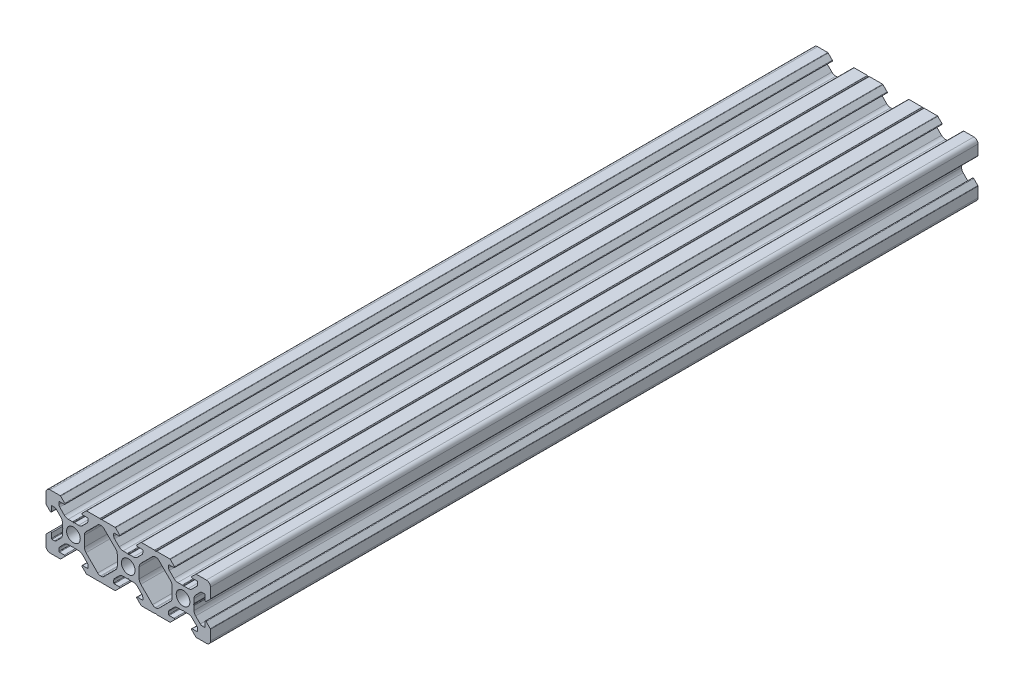
from build123d import *

# Parameters (mm, degrees)
SKETCH_187_R      = 2.5
EXTRUDE_748_DEPTH = 280


with BuildPart() as part:
    # Sketch 187 → Extrude 748 (new body)
    with BuildSketch(Plane.XY):
        with BuildLine():
            Line((37.369052302, 79.809178346), (37.369052302, 81.370263751))
            ThreePointArc((37.369052302, 81.370263751), (37.216811367, 82.135630615), (36.783265864, 82.784477313))
            Line((36.783265864, 82.784477313), (35.089153315, 84.478589863))
            ThreePointArc((35.089153315, 84.478589863), (34.764729966, 84.695362614), (34.382046533, 84.771483082))
            Line((34.382046533, 84.771483082), (33.569052302, 84.771483082))
            ThreePointArc((33.569052302, 84.771483082), (33.427630946, 84.712904438), (33.369052302, 84.571483082))
            Line((33.369052302, 84.571483082), (33.369052302, 82.801483082))
            ThreePointArc((33.369052302, 82.801483082), (33.21472316, 82.570513199), (32.942275607, 82.624706386))
            Line((32.942275607, 82.624706386), (31.442275607, 84.124706386))
            ThreePointArc((31.442275607, 84.124706386), (31.388082419, 84.205812224), (31.369052302, 84.301483082))
            Line((31.369052302, 84.301483082), (31.369052302, 87.971483082))
            ThreePointArc((31.369052302, 87.971483082), (31.80839213, 89.032143253), (32.869052302, 89.471483082))
            Line((32.869052302, 89.471483082), (36.539052302, 89.471483082))
            ThreePointArc((36.539052302, 89.471483082), (36.63472316, 89.452452965), (36.715828997, 89.398259777))
            Line((36.715828997, 89.398259777), (38.215828997, 87.898259777))
            ThreePointArc((38.215828997, 87.898259777), (38.270022185, 87.625812224), (38.039052302, 87.471483082))
            Line((38.039052302, 87.471483082), (36.269052302, 87.471483082))
            ThreePointArc((36.269052302, 87.471483082), (36.127630946, 87.412904438), (36.069052302, 87.271483082))
            Line((36.069052302, 87.271483082), (36.069052302, 86.45848885))
            ThreePointArc((36.069052302, 86.45848885), (36.145172769, 86.075805418), (36.361945521, 85.751382069))
            Line((36.361945521, 85.751382069), (38.05605807, 84.057269519))
            ThreePointArc((38.05605807, 84.057269519), (38.704904768, 83.623724017), (39.470271633, 83.471483082))
            Line((39.470271633, 83.471483082), (41.031357037, 83.471483082))
            ThreePointArc((41.031357037, 83.471483082), (41.114108772, 83.457390161), (41.187530799, 83.416700284))
            Line((41.187530799, 83.416700284), (41.369052302, 83.271483082))
            Line((41.369052302, 83.271483082), (41.550573805, 83.416700284))
            ThreePointArc((41.550573805, 83.416700284), (41.623995831, 83.457390161), (41.706747567, 83.471483082))
            Line((41.706747567, 83.471483082), (43.267832971, 83.471483082))
            ThreePointArc((43.267832971, 83.471483082), (44.033199836, 83.623724017), (44.682046533, 84.057269519))
            Line((44.682046533, 84.057269519), (46.376159083, 85.751382069))
            ThreePointArc((46.376159083, 85.751382069), (46.592931834, 86.075805418), (46.669052302, 86.45848885))
            Line((46.669052302, 86.45848885), (46.669052302, 87.271483082))
            ThreePointArc((46.669052302, 87.271483082), (46.610473658, 87.412904438), (46.469052302, 87.471483082))
            Line((46.469052302, 87.471483082), (44.699052302, 87.471483082))
            ThreePointArc((44.699052302, 87.471483082), (44.468082419, 87.625812224), (44.522275607, 87.898259777))
            Line((44.522275607, 87.898259777), (46.022275607, 89.398259777))
            ThreePointArc((46.022275607, 89.398259777), (46.103381444, 89.452452965), (46.199052302, 89.471483082))
            Line((46.199052302, 89.471483082), (50.993358392, 89.471483082))
            ThreePointArc((50.993358392, 89.471483082), (51.06580443, 89.460756088), (51.132033441, 89.429495655))
            Line((51.132033441, 89.429495655), (51.369052302, 89.271483082))
            Line((51.369052302, 89.271483082), (51.606071162, 89.429495655))
            ThreePointArc((51.606071162, 89.429495655), (51.672300174, 89.460756088), (51.744746211, 89.471483082))
            Line((51.744746211, 89.471483082), (56.539052302, 89.471483082))
            ThreePointArc((56.539052302, 89.471483082), (56.63472316, 89.452452965), (56.715828997, 89.398259777))
            Line((56.715828997, 89.398259777), (58.215828997, 87.898259777))
            ThreePointArc((58.215828997, 87.898259777), (58.270022185, 87.625812224), (58.039052302, 87.471483082))
            Line((58.039052302, 87.471483082), (56.269052302, 87.471483082))
            ThreePointArc((56.269052302, 87.471483082), (56.127630946, 87.412904438), (56.069052302, 87.271483082))
            Line((56.069052302, 87.271483082), (56.069052302, 86.45848885))
            ThreePointArc((56.069052302, 86.45848885), (56.145172769, 86.075805418), (56.361945521, 85.751382069))
            Line((56.361945521, 85.751382069), (58.05605807, 84.057269519))
            ThreePointArc((58.05605807, 84.057269519), (58.704904768, 83.623724017), (59.470271633, 83.471483082))
            Line((59.470271633, 83.471483082), (61.031357037, 83.471483082))
            ThreePointArc((61.031357037, 83.471483082), (61.114108772, 83.457390161), (61.187530799, 83.416700284))
            Line((61.187530799, 83.416700284), (61.369052302, 83.271483082))
            Line((61.369052302, 83.271483082), (61.550573805, 83.416700284))
            ThreePointArc((61.550573805, 83.416700284), (61.623995831, 83.457390161), (61.706747567, 83.471483082))
            Line((61.706747567, 83.471483082), (63.267832971, 83.471483082))
            ThreePointArc((63.267832971, 83.471483082), (64.033199836, 83.623724017), (64.682046533, 84.057269519))
            Line((64.682046533, 84.057269519), (66.376159083, 85.751382069))
            ThreePointArc((66.376159083, 85.751382069), (66.592931834, 86.075805418), (66.669052302, 86.45848885))
            Line((66.669052302, 86.45848885), (66.669052302, 87.271483082))
            ThreePointArc((66.669052302, 87.271483082), (66.610473658, 87.412904438), (66.469052302, 87.471483082))
            Line((66.469052302, 87.471483082), (64.699052302, 87.471483082))
            ThreePointArc((64.699052302, 87.471483082), (64.468082419, 87.625812224), (64.522275607, 87.898259777))
            Line((64.522275607, 87.898259777), (66.022275607, 89.398259777))
            ThreePointArc((66.022275607, 89.398259777), (66.103381444, 89.452452965), (66.199052302, 89.471483082))
            Line((66.199052302, 89.471483082), (70.993358392, 89.471483082))
            ThreePointArc((70.993358392, 89.471483082), (71.06580443, 89.460756088), (71.132033441, 89.429495655))
            Line((71.132033441, 89.429495655), (71.369052302, 89.271483082))
            Line((71.369052302, 89.271483082), (71.606071162, 89.429495655))
            ThreePointArc((71.606071162, 89.429495655), (71.672300174, 89.460756088), (71.744746211, 89.471483082))
            Line((71.744746211, 89.471483082), (76.539052302, 89.471483082))
            ThreePointArc((76.539052302, 89.471483082), (76.63472316, 89.452452965), (76.715828997, 89.398259777))
            Line((76.715828997, 89.398259777), (78.215828997, 87.898259777))
            ThreePointArc((78.215828997, 87.898259777), (78.270022185, 87.625812224), (78.039052302, 87.471483082))
            Line((78.039052302, 87.471483082), (76.269052302, 87.471483082))
            ThreePointArc((76.269052302, 87.471483082), (76.127630946, 87.412904438), (76.069052302, 87.271483082))
            Line((76.069052302, 87.271483082), (76.069052302, 86.45848885))
            ThreePointArc((76.069052302, 86.45848885), (76.145172769, 86.075805418), (76.361945521, 85.751382069))
            Line((76.361945521, 85.751382069), (78.05605807, 84.057269519))
            ThreePointArc((78.05605807, 84.057269519), (78.704904768, 83.623724017), (79.470271633, 83.471483082))
            Line((79.470271633, 83.471483082), (81.031357037, 83.471483082))
            ThreePointArc((81.031357037, 83.471483082), (81.114108772, 83.457390161), (81.187530799, 83.416700284))
            Line((81.187530799, 83.416700284), (81.369052302, 83.271483082))
            Line((81.369052302, 83.271483082), (81.550573805, 83.416700284))
            ThreePointArc((81.550573805, 83.416700284), (81.623995831, 83.457390161), (81.706747567, 83.471483082))
            Line((81.706747567, 83.471483082), (83.267832971, 83.471483082))
            ThreePointArc((83.267832971, 83.471483082), (84.033199836, 83.623724017), (84.682046533, 84.057269519))
            Line((84.682046533, 84.057269519), (86.376159083, 85.751382069))
            ThreePointArc((86.376159083, 85.751382069), (86.592931834, 86.075805418), (86.669052302, 86.45848885))
            Line((86.669052302, 86.45848885), (86.669052302, 87.271483082))
            ThreePointArc((86.669052302, 87.271483082), (86.610473658, 87.412904438), (86.469052302, 87.471483082))
            Line((86.469052302, 87.471483082), (84.699052302, 87.471483082))
            ThreePointArc((84.699052302, 87.471483082), (84.468082419, 87.625812224), (84.522275607, 87.898259777))
            Line((84.522275607, 87.898259777), (86.022275607, 89.398259777))
            ThreePointArc((86.022275607, 89.398259777), (86.103381444, 89.452452965), (86.199052302, 89.471483082))
            Line((86.199052302, 89.471483082), (89.869052302, 89.471483082))
            ThreePointArc((89.869052302, 89.471483082), (90.929712474, 89.032143253), (91.369052302, 87.971483082))
            Line((91.369052302, 87.971483082), (91.369052302, 84.301483082))
            ThreePointArc((91.369052302, 84.301483082), (91.350022185, 84.205812224), (91.295828997, 84.124706386))
            Line((91.295828997, 84.124706386), (89.795828997, 82.624706386))
            ThreePointArc((89.795828997, 82.624706386), (89.523381444, 82.570513199), (89.369052302, 82.801483082))
            Line((89.369052302, 82.801483082), (89.369052302, 84.571483082))
            ThreePointArc((89.369052302, 84.571483082), (89.310473658, 84.712904438), (89.169052302, 84.771483082))
            Line((89.169052302, 84.771483082), (88.35605807, 84.771483082))
            ThreePointArc((88.35605807, 84.771483082), (87.973374638, 84.695362614), (87.648951289, 84.478589863))
            Line((87.648951289, 84.478589863), (85.954838739, 82.784477313))
            ThreePointArc((85.954838739, 82.784477313), (85.521293237, 82.135630615), (85.369052302, 81.370263751))
            Line((85.369052302, 81.370263751), (85.369052302, 79.809178346))
            ThreePointArc((85.369052302, 79.809178346), (85.354959382, 79.726426611), (85.314269504, 79.653004585))
            Line((85.314269504, 79.653004585), (85.169052302, 79.471483082))
            Line((85.169052302, 79.471483082), (85.314269504, 79.289961579))
            ThreePointArc((85.314269504, 79.289961579), (85.354959382, 79.216539552), (85.369052302, 79.133787817))
            Line((85.369052302, 79.133787817), (85.369052302, 77.572702413))
            ThreePointArc((85.369052302, 77.572702413), (85.521293237, 76.807335548), (85.954838739, 76.15848885))
            Line((85.954838739, 76.15848885), (87.648951289, 74.4643763))
            ThreePointArc((87.648951289, 74.4643763), (87.973374638, 74.247603549), (88.35605807, 74.171483082))
            Line((88.35605807, 74.171483082), (89.169052302, 74.171483082))
            ThreePointArc((89.169052302, 74.171483082), (89.310473658, 74.230061725), (89.369052302, 74.371483082))
            Line((89.369052302, 74.371483082), (89.369052302, 76.141483082))
            ThreePointArc((89.369052302, 76.141483082), (89.523381444, 76.372452965), (89.795828997, 76.318259777))
            Line((89.795828997, 76.318259777), (91.295828997, 74.818259777))
            ThreePointArc((91.295828997, 74.818259777), (91.350022185, 74.73715394), (91.369052302, 74.641483082))
            Line((91.369052302, 74.641483082), (91.369052302, 70.971483082))
            ThreePointArc((91.369052302, 70.971483082), (90.929712474, 69.91082291), (89.869052302, 69.471483082))
            Line((89.869052302, 69.471483082), (86.199052302, 69.471483082))
            ThreePointArc((86.199052302, 69.471483082), (86.103381444, 69.490513199), (86.022275607, 69.544706386))
            Line((86.022275607, 69.544706386), (84.522275607, 71.044706386))
            ThreePointArc((84.522275607, 71.044706386), (84.468082419, 71.31715394), (84.699052302, 71.471483082))
            Line((84.699052302, 71.471483082), (86.469052302, 71.471483082))
            ThreePointArc((86.469052302, 71.471483082), (86.610473658, 71.530061725), (86.669052302, 71.671483082))
            Line((86.669052302, 71.671483082), (86.669052302, 72.484477313))
            ThreePointArc((86.669052302, 72.484477313), (86.592931834, 72.867160745), (86.376159083, 73.191584094))
            Line((86.376159083, 73.191584094), (84.682046533, 74.885696644))
            ThreePointArc((84.682046533, 74.885696644), (84.033199836, 75.319242147), (83.267832971, 75.471483082))
            Line((83.267832971, 75.471483082), (81.706747567, 75.471483082))
            ThreePointArc((81.706747567, 75.471483082), (81.623995831, 75.485576002), (81.550573805, 75.526265879))
            Line((81.550573805, 75.526265879), (81.369052302, 75.671483082))
            Line((81.369052302, 75.671483082), (81.187530799, 75.526265879))
            ThreePointArc((81.187530799, 75.526265879), (81.114108772, 75.485576002), (81.031357037, 75.471483082))
            Line((81.031357037, 75.471483082), (79.470271633, 75.471483082))
            ThreePointArc((79.470271633, 75.471483082), (78.704904768, 75.319242147), (78.05605807, 74.885696644))
            Line((78.05605807, 74.885696644), (76.361945521, 73.191584094))
            ThreePointArc((76.361945521, 73.191584094), (76.145172769, 72.867160745), (76.069052302, 72.484477313))
            Line((76.069052302, 72.484477313), (76.069052302, 71.671483082))
            ThreePointArc((76.069052302, 71.671483082), (76.127630946, 71.530061725), (76.269052302, 71.471483082))
            Line((76.269052302, 71.471483082), (78.039052302, 71.471483082))
            ThreePointArc((78.039052302, 71.471483082), (78.270022185, 71.31715394), (78.215828997, 71.044706386))
            Line((78.215828997, 71.044706386), (76.715828997, 69.544706386))
            ThreePointArc((76.715828997, 69.544706386), (76.63472316, 69.490513199), (76.539052302, 69.471483082))
            Line((76.539052302, 69.471483082), (71.744746211, 69.471483082))
            ThreePointArc((71.744746211, 69.471483082), (71.672300174, 69.482210075), (71.606071162, 69.513470508))
            Line((71.606071162, 69.513470508), (71.369052302, 69.671483082))
            Line((71.369052302, 69.671483082), (71.132033441, 69.513470508))
            ThreePointArc((71.132033441, 69.513470508), (71.06580443, 69.482210075), (70.993358392, 69.471483082))
            Line((70.993358392, 69.471483082), (66.199052302, 69.471483082))
            ThreePointArc((66.199052302, 69.471483082), (66.103381444, 69.490513199), (66.022275607, 69.544706386))
            Line((66.022275607, 69.544706386), (64.522275607, 71.044706386))
            ThreePointArc((64.522275607, 71.044706386), (64.468082419, 71.31715394), (64.699052302, 71.471483082))
            Line((64.699052302, 71.471483082), (66.469052302, 71.471483082))
            ThreePointArc((66.469052302, 71.471483082), (66.610473658, 71.530061725), (66.669052302, 71.671483082))
            Line((66.669052302, 71.671483082), (66.669052302, 72.484477313))
            ThreePointArc((66.669052302, 72.484477313), (66.592931834, 72.867160745), (66.376159083, 73.191584094))
            Line((66.376159083, 73.191584094), (64.682046533, 74.885696644))
            ThreePointArc((64.682046533, 74.885696644), (64.033199836, 75.319242147), (63.267832971, 75.471483082))
            Line((63.267832971, 75.471483082), (61.706747567, 75.471483082))
            ThreePointArc((61.706747567, 75.471483082), (61.623995831, 75.485576002), (61.550573805, 75.526265879))
            Line((61.550573805, 75.526265879), (61.369052302, 75.671483082))
            Line((61.369052302, 75.671483082), (61.187530799, 75.526265879))
            ThreePointArc((61.187530799, 75.526265879), (61.114108772, 75.485576002), (61.031357037, 75.471483082))
            Line((61.031357037, 75.471483082), (59.470271633, 75.471483082))
            ThreePointArc((59.470271633, 75.471483082), (58.704904768, 75.319242147), (58.05605807, 74.885696644))
            Line((58.05605807, 74.885696644), (56.361945521, 73.191584094))
            ThreePointArc((56.361945521, 73.191584094), (56.145172769, 72.867160745), (56.069052302, 72.484477313))
            Line((56.069052302, 72.484477313), (56.069052302, 71.671483082))
            ThreePointArc((56.069052302, 71.671483082), (56.127630946, 71.530061725), (56.269052302, 71.471483082))
            Line((56.269052302, 71.471483082), (58.039052302, 71.471483082))
            ThreePointArc((58.039052302, 71.471483082), (58.270022185, 71.31715394), (58.215828997, 71.044706386))
            Line((58.215828997, 71.044706386), (56.715828997, 69.544706386))
            ThreePointArc((56.715828997, 69.544706386), (56.63472316, 69.490513199), (56.539052302, 69.471483082))
            Line((56.539052302, 69.471483082), (51.744746211, 69.471483082))
            ThreePointArc((51.744746211, 69.471483082), (51.672300174, 69.482210075), (51.606071162, 69.513470508))
            Line((51.606071162, 69.513470508), (51.369052302, 69.671483082))
            Line((51.369052302, 69.671483082), (51.132033441, 69.513470508))
            ThreePointArc((51.132033441, 69.513470508), (51.06580443, 69.482210075), (50.993358392, 69.471483082))
            Line((50.993358392, 69.471483082), (46.199052302, 69.471483082))
            ThreePointArc((46.199052302, 69.471483082), (46.103381444, 69.490513199), (46.022275607, 69.544706386))
            Line((46.022275607, 69.544706386), (44.522275607, 71.044706386))
            ThreePointArc((44.522275607, 71.044706386), (44.468082419, 71.31715394), (44.699052302, 71.471483082))
            Line((44.699052302, 71.471483082), (46.469052302, 71.471483082))
            ThreePointArc((46.469052302, 71.471483082), (46.610473658, 71.530061725), (46.669052302, 71.671483082))
            Line((46.669052302, 71.671483082), (46.669052302, 72.484477313))
            ThreePointArc((46.669052302, 72.484477313), (46.592931834, 72.867160745), (46.376159083, 73.191584094))
            Line((46.376159083, 73.191584094), (44.682046533, 74.885696644))
            ThreePointArc((44.682046533, 74.885696644), (44.033199836, 75.319242147), (43.267832971, 75.471483082))
            Line((43.267832971, 75.471483082), (41.706747567, 75.471483082))
            ThreePointArc((41.706747567, 75.471483082), (41.623995831, 75.485576002), (41.550573805, 75.526265879))
            Line((41.550573805, 75.526265879), (41.369052302, 75.671483082))
            Line((41.369052302, 75.671483082), (41.187530799, 75.526265879))
            ThreePointArc((41.187530799, 75.526265879), (41.114108772, 75.485576002), (41.031357037, 75.471483082))
            Line((41.031357037, 75.471483082), (39.470271633, 75.471483082))
            ThreePointArc((39.470271633, 75.471483082), (38.704904768, 75.319242147), (38.05605807, 74.885696644))
            Line((38.05605807, 74.885696644), (36.361945521, 73.191584094))
            ThreePointArc((36.361945521, 73.191584094), (36.145172769, 72.867160745), (36.069052302, 72.484477313))
            Line((36.069052302, 72.484477313), (36.069052302, 71.671483082))
            ThreePointArc((36.069052302, 71.671483082), (36.127630946, 71.530061725), (36.269052302, 71.471483082))
            Line((36.269052302, 71.471483082), (38.039052302, 71.471483082))
            ThreePointArc((38.039052302, 71.471483082), (38.270022185, 71.31715394), (38.215828997, 71.044706386))
            Line((38.215828997, 71.044706386), (36.715828997, 69.544706386))
            ThreePointArc((36.715828997, 69.544706386), (36.63472316, 69.490513199), (36.539052302, 69.471483082))
            Line((36.539052302, 69.471483082), (32.869052302, 69.471483082))
            ThreePointArc((32.869052302, 69.471483082), (31.80839213, 69.91082291), (31.369052302, 70.971483082))
            Line((31.369052302, 70.971483082), (31.369052302, 74.641483082))
            ThreePointArc((31.369052302, 74.641483082), (31.388082419, 74.73715394), (31.442275607, 74.818259777))
            Line((31.442275607, 74.818259777), (32.942275607, 76.318259777))
            ThreePointArc((32.942275607, 76.318259777), (33.21472316, 76.372452965), (33.369052302, 76.141483082))
            Line((33.369052302, 76.141483082), (33.369052302, 74.371483082))
            ThreePointArc((33.369052302, 74.371483082), (33.427630946, 74.230061725), (33.569052302, 74.171483082))
            Line((33.569052302, 74.171483082), (34.382046533, 74.171483082))
            ThreePointArc((34.382046533, 74.171483082), (34.764729966, 74.247603549), (35.089153315, 74.4643763))
            Line((35.089153315, 74.4643763), (36.783265864, 76.15848885))
            ThreePointArc((36.783265864, 76.15848885), (37.216811367, 76.807335548), (37.369052302, 77.572702413))
            Line((37.369052302, 77.572702413), (37.369052302, 79.133787817))
            ThreePointArc((37.369052302, 79.133787817), (37.383145222, 79.216539552), (37.423835099, 79.289961579))
            Line((37.423835099, 79.289961579), (37.569052302, 79.471483082))
            Line((37.569052302, 79.471483082), (37.423835099, 79.653004585))
            ThreePointArc((37.423835099, 79.653004585), (37.383145222, 79.726426611), (37.369052302, 79.809178346))
        make_face()
        with Locations((81.369052302, 79.471483082)):
            Circle(SKETCH_187_R, mode=Mode.SUBTRACT)
        with Locations((61.369052302, 79.471483082)):
            Circle(SKETCH_187_R, mode=Mode.SUBTRACT)
        with Locations((41.369052302, 79.471483082)):
            Circle(SKETCH_187_R, mode=Mode.SUBTRACT)
        with BuildLine():
            Line((77.369052302, 77.572702413), (77.369052302, 81.370263751))
            ThreePointArc((77.369052302, 81.370263751), (77.216811367, 82.135630615), (76.783265864, 82.784477313))
            Line((76.783265864, 82.784477313), (72.506310602, 87.061432575))
            ThreePointArc((72.506310602, 87.061432575), (72.052117914, 87.364914427), (71.516361108, 87.471483082))
            Line((71.516361108, 87.471483082), (71.221743495, 87.471483082))
            ThreePointArc((71.221743495, 87.471483082), (70.68598669, 87.364914427), (70.231794002, 87.061432575))
            Line((70.231794002, 87.061432575), (65.954838739, 82.784477313))
            ThreePointArc((65.954838739, 82.784477313), (65.521293237, 82.135630615), (65.369052302, 81.370263751))
            Line((65.369052302, 81.370263751), (65.369052302, 77.572702413))
            ThreePointArc((65.369052302, 77.572702413), (65.521293237, 76.807335548), (65.954838739, 76.15848885))
            Line((65.954838739, 76.15848885), (70.231794002, 71.881533588))
            ThreePointArc((70.231794002, 71.881533588), (70.68598669, 71.578051736), (71.221743495, 71.471483082))
            Line((71.221743495, 71.471483082), (71.516361108, 71.471483082))
            ThreePointArc((71.516361108, 71.471483082), (72.052117914, 71.578051736), (72.506310602, 71.881533588))
            Line((72.506310602, 71.881533588), (76.783265864, 76.15848885))
            ThreePointArc((76.783265864, 76.15848885), (77.216811367, 76.807335548), (77.369052302, 77.572702413))
        make_face(mode=Mode.SUBTRACT)
        with BuildLine():
            Line((45.954838739, 76.15848885), (50.231794002, 71.881533588))
            ThreePointArc((50.231794002, 71.881533588), (50.68598669, 71.578051736), (51.221743495, 71.471483082))
            Line((51.221743495, 71.471483082), (51.516361108, 71.471483082))
            ThreePointArc((51.516361108, 71.471483082), (52.052117914, 71.578051736), (52.506310602, 71.881533588))
            Line((52.506310602, 71.881533588), (56.783265864, 76.15848885))
            ThreePointArc((56.783265864, 76.15848885), (57.216811367, 76.807335548), (57.369052302, 77.572702413))
            Line((57.369052302, 77.572702413), (57.369052302, 81.370263751))
            ThreePointArc((57.369052302, 81.370263751), (57.216811367, 82.135630615), (56.783265864, 82.784477313))
            Line((56.783265864, 82.784477313), (52.506310602, 87.061432575))
            ThreePointArc((52.506310602, 87.061432575), (52.052117914, 87.364914427), (51.516361108, 87.471483082))
            Line((51.516361108, 87.471483082), (51.221743495, 87.471483082))
            ThreePointArc((51.221743495, 87.471483082), (50.68598669, 87.364914427), (50.231794002, 87.061432575))
            Line((50.231794002, 87.061432575), (45.954838739, 82.784477313))
            ThreePointArc((45.954838739, 82.784477313), (45.521293237, 82.135630615), (45.369052302, 81.370263751))
            Line((45.369052302, 81.370263751), (45.369052302, 77.572702413))
            ThreePointArc((45.369052302, 77.572702413), (45.521293237, 76.807335548), (45.954838739, 76.15848885))
        make_face(mode=Mode.SUBTRACT)
    extrude(amount=EXTRUDE_748_DEPTH)


solid = part.part
